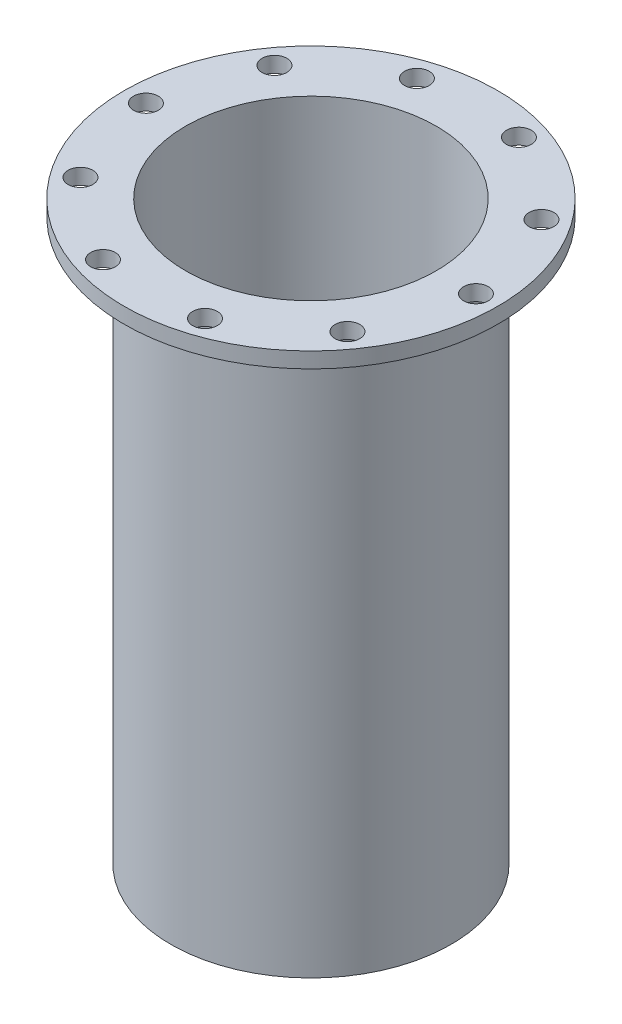
from build123d import *

# Parameters (mm, degrees)
TAP_DRILL_FOR_3_8_16_TAP1_D = 10.0838
CIRPATTERN1_COUNT           = 10


with BuildPart() as part:
    # Sketch1 → Revolve1 (revolve)
    with BuildSketch(Plane.XY, mode=Mode.PRIVATE) as revolve1_sk:
        Polygon((51.1302, 0), (51.1302, -213.995), (53.6702, -213.995), (53.6702, -217.043), (51.1302, -217.043), (51.1302, -234.95), (57.15, -234.95), (57.15, -6.35), (76.2, -6.35), (76.2, 0), align=None)
    revolve(revolve1_sk.sketch.rotate(Axis((0, 0, 0), (0, -1, 0)), 180), axis=Axis((0, 0, 0), (0, -1, 0)))

    # Tap Drill for 3/8-16 Tap1 (through all)
    with Locations(Plane(origin=(0, 0, 0), x_dir=(1, 0, 0), z_dir=(0, 1, 0))):
        with Locations((67.31, 0)):
            tap_drill_for_3_8_16_tap1 = Hole(TAP_DRILL_FOR_3_8_16_TAP1_D / 2)

    # CirPattern1: Tap Drill for 3/8-16 Tap1 ×10 about axis
    cirpattern1_axis = Axis((0, 0, 0), (0, 1, 0))
    for i in range(1, CIRPATTERN1_COUNT):
        add(tap_drill_for_3_8_16_tap1.rotate(cirpattern1_axis, i * 360 / CIRPATTERN1_COUNT), mode=Mode.SUBTRACT)


solid = part.part
